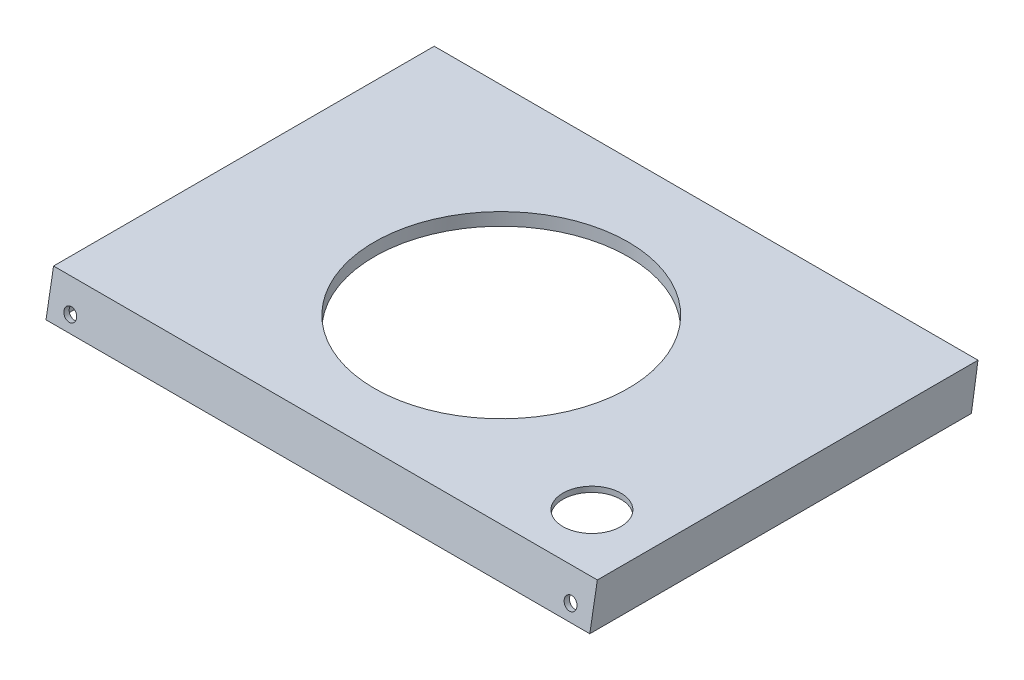
from build123d import *
from build123d.topology import SkipClean

# Parameters (mm, degrees)
SKETCH_1_W          = 147
SKETCH_1_H          = 105
SKETCH_1_R          = 35
SKETCH_1_R_2        = 8
EXTRUDE_1_DEPTH     = 1.5
EXTRUDE_2_DEPTH     = 147
EXTRUDE_3_DEPTH     = 1.5
EXTRUDE_4_DEPTH     = 1.5
SKETCH_5_R          = 3
SKETCH_5_R_2        = 1.1
EXTRUDE_5_DEPTH     = 5
CUT_EXTRUDE_1_REACH = 184.29
SKETCH_6_R          = 1.75
CUT_EXTRUDE_2_REACH = 184.314
SKETCH_7_R          = 1.75
EXTRUDE_START       = 2
SKETCH_8_R          = 36.5
SKETCH_8_R_2        = 35
EXTRUDE_6_DEPTH     = 2


with BuildPart() as part:
    # 草图1 → 凸台-拉伸1 (new body)
    with BuildSketch(Plane(origin=(0, 0, 0), x_dir=(1, 0, 0), z_dir=(0, 1, 0))):
        with Locations((73.5, 52.5)):
            Rectangle(SKETCH_1_W, SKETCH_1_H)
        with Locations(Location((72, 50, 0), (0, 0, 270))):
            Circle(SKETCH_1_R, mode=Mode.SUBTRACT)
        with Locations(Location((131, 16, 0), (0, 0, 270))):
            Circle(SKETCH_1_R_2, mode=Mode.SUBTRACT)
    extrude(amount=EXTRUDE_1_DEPTH)

    # 草图2 → 凸台-拉伸2 (add)
    with BuildSketch(Plane.ZY):
        Polygon((0, 1.5), (2.083778132, -10.317693036), (0.560638214, -10.317693036), (-1.523139918, 1.5), align=None)
        Polygon((-105, 0), (-103.180712339, -10.317693036), (-101.657572421, -10.317693036), (-103.741350553, 1.5), align=None)
    extrude(amount=-EXTRUDE_2_DEPTH)

    # 草图3 → 凸台-拉伸3 (add)
    with BuildSketch(Plane(origin=(147, 0, 0), x_dir=(0, 0, -1), z_dir=(1, 0, 0))):
        Polygon((-2.083778132, -10.317693036), (0, 1.5), (105, 1.5), (103.180712339, -10.317693036), align=None)
    extrude(amount=EXTRUDE_3_DEPTH)

    # 草图4 → 凸台-拉伸4 (add)
    with BuildSketch(Plane.ZY):
        Polygon((-103.180712339, -10.317693036), (-105, 1.5), (0, 1.5), (2.083778132, -10.317693036), align=None)
    extrude(amount=EXTRUDE_4_DEPTH)

    # 草图5 → 凸台-拉伸5 (add)
    # profile 1 of 4: a face of its own
    with BuildSketch(Plane.XZ):
        with Locations(Location((141, -95.657572421, 0), (0, 0, 270))):
            Circle(SKETCH_5_R)
        with Locations(Location((141, -95.657572421, 0), (0, 0, 270))):
            Circle(SKETCH_5_R_2, mode=Mode.SUBTRACT)
    # profile 2 of 4: a face of its own
    with BuildSketch(Plane.XZ):
        with Locations(Location((117, -95.657572421, 0), (0, 0, 90))):
            Circle(SKETCH_5_R)
        with Locations(Location((117, -95.657572421, 0), (0, 0, 90))):
            Circle(SKETCH_5_R_2, mode=Mode.SUBTRACT)
    # profile 3 of 4: a face of its own
    with BuildSketch(Plane.XZ):
        with Locations(Location((117, -48.657572421, 0), (0, 0, 270))):
            Circle(SKETCH_5_R)
        with Locations(Location((117, -48.657572421, 0), (0, 0, 270))):
            Circle(SKETCH_5_R_2, mode=Mode.SUBTRACT)
    # profile 4 of 4: a face of its own
    with BuildSketch(Plane.XZ):
        with Locations(Location((141, -48.657572421, 0), (0, 0, 90))):
            Circle(SKETCH_5_R)
        with Locations(Location((141, -48.657572421, 0), (0, 0, 90))):
            Circle(SKETCH_5_R_2, mode=Mode.SUBTRACT)
    extrude(amount=EXTRUDE_5_DEPTH)

    # 草图6 → 切除-拉伸1 (cut, up to next)
    with BuildSketch(Plane(origin=(0, -17.956057525, -101.833862591), x_dir=(-1, 0, 0), z_dir=(0, -0.17364817766692459, -0.9848077530122091)), mode=Mode.PRIVATE) as cut_extrude_1_sk1:
        with Locations(Location((-142.5, 11.756198573, 0), (0, 0, 90))):
            Circle(SKETCH_6_R)
    cut_extrude_1_tool1 = extrude(cut_extrude_1_sk1.sketch, amount=-CUT_EXTRUDE_1_REACH, mode=Mode.PRIVATE) & part.part
    # 草图6 → 切除-拉伸1 (cut, up to next)
    with BuildSketch(Plane(origin=(0, -17.956057525, -101.833862591), x_dir=(-1, 0, 0), z_dir=(0, -0.17364817766692459, -0.9848077530122091)), mode=Mode.PRIVATE) as cut_extrude_1_sk2:
        with Locations(Location((-4.5, 11.756198573, 0), (0, 0, 270))):
            Circle(SKETCH_6_R)
    cut_extrude_1_tool2 = extrude(cut_extrude_1_sk2.sketch, amount=-CUT_EXTRUDE_1_REACH, mode=Mode.PRIVATE) & part.part
    add(cut_extrude_1_tool1.solids().sort_by_distance((142.5, -6.378462, -103.875305))[0], mode=Mode.SUBTRACT)
    add(cut_extrude_1_tool2.solids().sort_by_distance((4.5, -6.378462, -103.875305))[0], mode=Mode.SUBTRACT)

    # 草图7 → 切除-拉伸2 (cut, up to next)
    with BuildSketch(Plane(origin=(0, 0.045230534, 0.256515107), x_dir=(1, 0, 0), z_dir=(0, 0.1736481776669238, 0.9848077530122094)), mode=Mode.PRIVATE) as cut_extrude_2_sk1:
        with Locations(Location((4.5, -6.52278837, 0), (0, 0, 270))):
            Circle(SKETCH_7_R)
    cut_extrude_2_tool1 = extrude(cut_extrude_2_sk1.sketch, amount=-CUT_EXTRUDE_2_REACH, mode=Mode.PRIVATE) & part.part
    # 草图7 → 切除-拉伸2 (cut, up to next)
    with BuildSketch(Plane(origin=(0, 0.045230534, 0.256515107), x_dir=(1, 0, 0), z_dir=(0, 0.1736481776669238, 0.9848077530122094)), mode=Mode.PRIVATE) as cut_extrude_2_sk2:
        with Locations(Location((142.5, -6.52278837, 0), (0, 0, 90))):
            Circle(SKETCH_7_R)
    cut_extrude_2_tool2 = extrude(cut_extrude_2_sk2.sketch, amount=-CUT_EXTRUDE_2_REACH, mode=Mode.PRIVATE) & part.part
    add(cut_extrude_2_tool1.solids().sort_by_distance((4.5, -6.378462, 1.389185))[0], mode=Mode.SUBTRACT)
    add(cut_extrude_2_tool2.solids().sort_by_distance((142.5, -6.378462, 1.389185))[0], mode=Mode.SUBTRACT)

    # 草图8 → 凸台-拉伸6 (add)
    with SkipClean():  # the faces are left unmerged after this step: merging them gives an invalid solid
        with BuildSketch(Plane.XZ.offset(EXTRUDE_START)):
            with Locations(Location((72, -50, 0), (0, 0, 270))):
                Circle(SKETCH_8_R)
            with Locations(Location((72, -50, 0), (0, 0, 270))):
                Circle(SKETCH_8_R_2, mode=Mode.SUBTRACT)
        extrude(amount=-EXTRUDE_6_DEPTH)


solid = part.part
